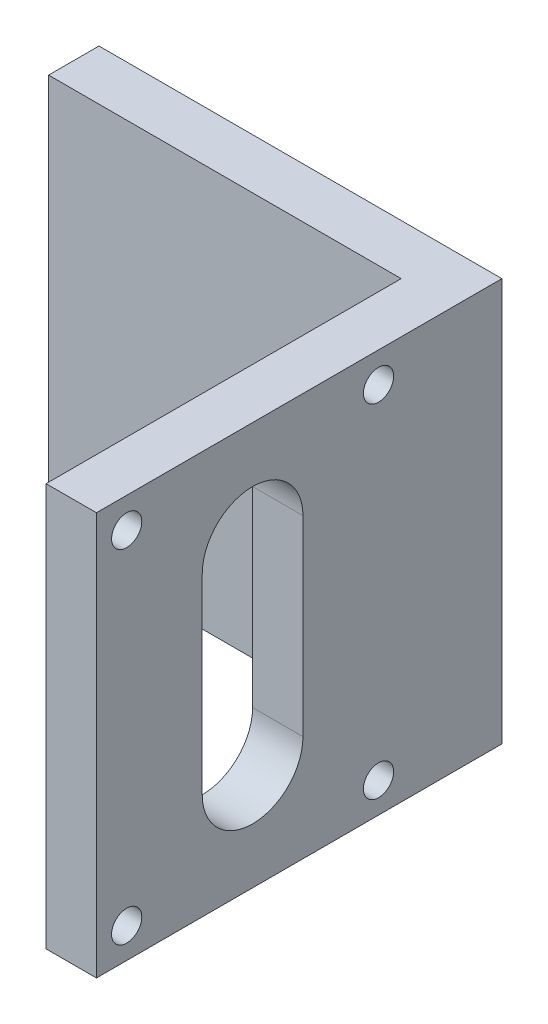
from build123d import *

# Parameters (mm, degrees)
BOSS_EXTRUDE1_DEPTH = 80
SKETCH2_R           = 3
CUT_EXTRUDE1_DEPTH  = 10
CUT_EXTRUDE2_DEPTH  = 10


with BuildPart() as part:
    # Sketch1 → Boss-Extrude1 (new body)
    with BuildSketch(Plane(origin=(0, 0, 0), x_dir=(1, 0, 0), z_dir=(0, 1, 0))):
        Polygon((0, 0), (0, 80.5), (-80, 80.5), (-80, 70.5), (-10, 70.5), (-10, 0), align=None)
    extrude(amount=BOSS_EXTRUDE1_DEPTH)

    # Sketch2 → Cut-Extrude1 (cut)
    with BuildSketch(Plane(origin=(0, 0, 0), x_dir=(0, 0, -1), z_dir=(1, 0, 0))):
        with Locations((6, 6)):
            Circle(SKETCH2_R)
        with Locations((6, 74)):
            Circle(SKETCH2_R)
        with Locations((56, 74)):
            Circle(SKETCH2_R)
        with Locations((56, 6)):
            Circle(SKETCH2_R)
    extrude(amount=-CUT_EXTRUDE1_DEPTH, mode=Mode.SUBTRACT)

    # Sketch3 → Cut-Extrude2 (cut)
    with BuildSketch(Plane(origin=(0, 0, 0), x_dir=(0, 0, -1), z_dir=(1, 0, 0))):
        with BuildLine():
            Line((21, 59), (21, 21))
            ThreePointArc((21, 21), (23.928932188, 13.928932188), (31, 11))
            ThreePointArc((31, 11), (38.071067812, 13.928932188), (41, 21))
            Line((41, 21), (41, 59))
            ThreePointArc((41, 59), (38.071067812, 66.071067812), (31, 69))
            ThreePointArc((31, 69), (23.928932188, 66.071067812), (21, 59))
        make_face()
    extrude(amount=-CUT_EXTRUDE2_DEPTH, mode=Mode.SUBTRACT)


solid = part.part
